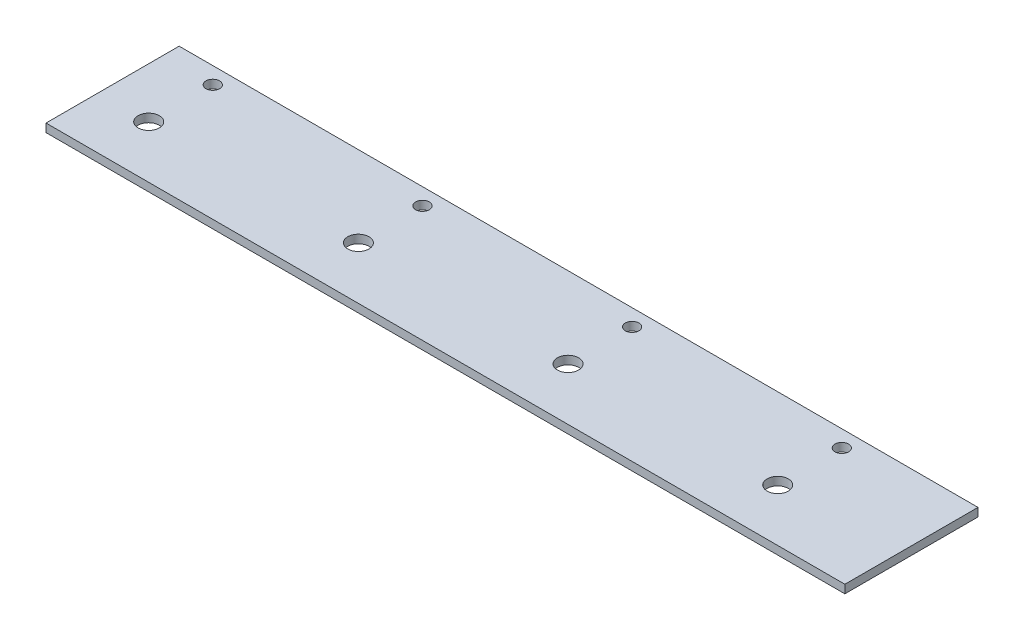
from build123d import *

# Parameters (mm, degrees)
SKETCH1_W           = 304.8
SKETCH1_H           = 50.8
SKETCH1_R           = 2.6
SKETCH1_R_2         = 4.05
BOSS_EXTRUDE1_DEPTH = 3.175


with BuildPart() as part:
    # Sketch1 → Boss-Extrude1 (new body)
    with BuildSketch(Plane(origin=(0, 0, 0), x_dir=(1, 0, 0), z_dir=(0, 1, 0))):
        with Locations((152.4, 25.4)):
            Rectangle(SKETCH1_W, SKETCH1_H)
        with Locations(Location((19.185127899, 44.45, 0), (0, 0, 270))):
            Circle(SKETCH1_R, mode=Mode.SUBTRACT)
        with Locations(Location((19.185127899, 20, 0), (0, 0, 270))):
            Circle(SKETCH1_R_2, mode=Mode.SUBTRACT)
        with Locations(Location((99.185127899, 20, 0), (0, 0, 270))):
            Circle(SKETCH1_R_2, mode=Mode.SUBTRACT)
        with Locations(Location((99.185127899, 44.45, 0), (0, 0, 270))):
            Circle(SKETCH1_R, mode=Mode.SUBTRACT)
        with Locations(Location((179.185127899, 20, 0), (0, 0, 270))):
            Circle(SKETCH1_R_2, mode=Mode.SUBTRACT)
        with Locations(Location((179.185127899, 44.45, 0), (0, 0, 270))):
            Circle(SKETCH1_R, mode=Mode.SUBTRACT)
        with Locations(Location((259.185127899, 20, 0), (0, 0, 270))):
            Circle(SKETCH1_R_2, mode=Mode.SUBTRACT)
        with Locations(Location((259.185127899, 44.45, 0), (0, 0, 270))):
            Circle(SKETCH1_R, mode=Mode.SUBTRACT)
    extrude(amount=BOSS_EXTRUDE1_DEPTH)


solid = part.part
